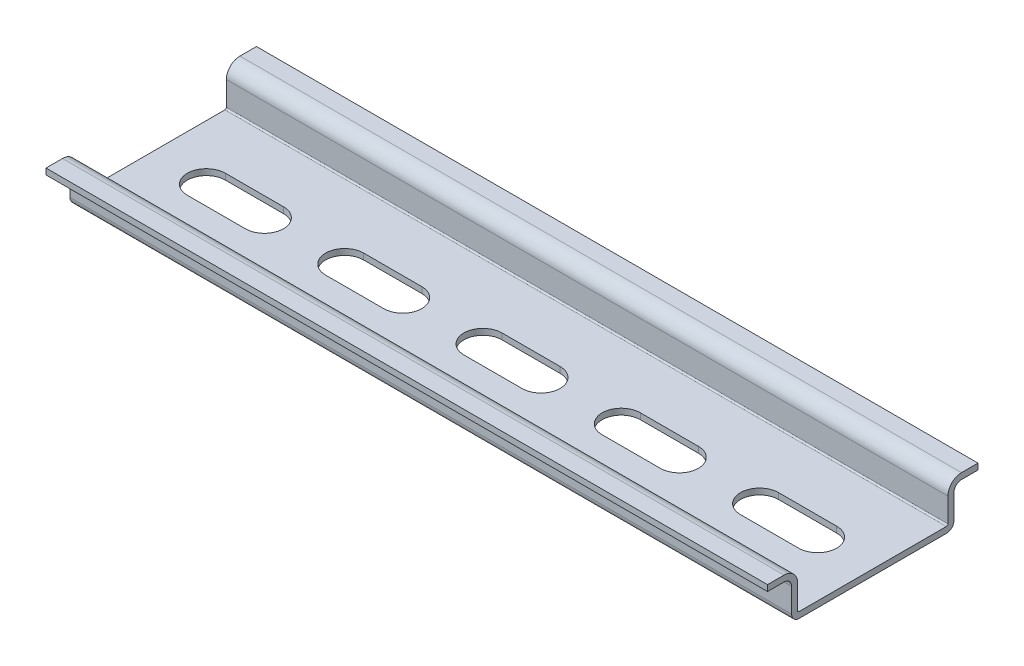
from build123d import *

# Parameters (mm, degrees)
BOSS_EXTRUDE1_DEPTH = 60
CUT_EXTRUDE1_DEPTH  = 120


with BuildPart() as part:
    # Sketch1 → Boss-Extrude1 (new, symmetric)
    with BuildSketch(Plane(origin=(0, 0, 0), x_dir=(0, 0, -1), z_dir=(1, 0, 0))):
        with BuildLine():
            Line((12.25, 0), (-12.25, 0))
            ThreePointArc((-12.25, 0), (-13.133883476, 0.366116524), (-13.5, 1.25))
            Line((-13.5, 1.25), (-13.5, 5.25))
            ThreePointArc((-13.5, 5.25), (-13.866116524, 6.133883476), (-14.75, 6.5))
            Line((-14.75, 6.5), (-17.5, 6.5))
            Line((-17.5, 6.5), (-17.5, 7.5))
            Line((-17.5, 7.5), (-14.75, 7.5))
            ThreePointArc((-14.75, 7.5), (-13.159009742, 6.840990258), (-12.5, 5.25))
            Line((-12.5, 5.25), (-12.5, 1.25))
            ThreePointArc((-12.5, 1.25), (-12.426776695, 1.073223305), (-12.25, 1))
            Line((-12.25, 1), (12.25, 1))
            ThreePointArc((12.25, 1), (12.426776695, 1.073223305), (12.5, 1.25))
            Line((12.5, 1.25), (12.5, 5.25))
            ThreePointArc((12.5, 5.25), (13.159009742, 6.840990258), (14.75, 7.5))
            Line((14.75, 7.5), (17.5, 7.5))
            Line((17.5, 7.5), (17.5, 6.5))
            Line((17.5, 6.5), (14.75, 6.5))
            ThreePointArc((14.75, 6.5), (13.866116524, 6.133883476), (13.5, 5.25))
            Line((13.5, 5.25), (13.5, 1.25))
            ThreePointArc((13.5, 1.25), (13.133883476, 0.366116524), (12.25, 0))
        make_face()
    extrude(amount=BOSS_EXTRUDE1_DEPTH, both=True)

    # Sketch2 → Cut-Extrude1 (cut)
    with BuildSketch(Plane.XZ):
        with BuildLine():
            Line((-4.83, 3.17), (4.83, 3.17))
            ThreePointArc((4.83, 3.17), (8, 0), (4.83, -3.17))
            Line((4.83, -3.17), (-4.83, -3.17))
            ThreePointArc((-4.83, -3.17), (-8, 0), (-4.83, 3.17))
        make_face()
        with BuildLine():
            Line((18.17, -3.17), (27.83, -3.17))
            ThreePointArc((27.83, -3.17), (31, 0), (27.83, 3.17))
            Line((27.83, 3.17), (18.17, 3.17))
            ThreePointArc((18.17, 3.17), (15, 0), (18.17, -3.17))
        make_face()
        with BuildLine():
            Line((-27.83, -3.17), (-18.17, -3.17))
            ThreePointArc((-18.17, -3.17), (-15, 0), (-18.17, 3.17))
            Line((-18.17, 3.17), (-27.83, 3.17))
            ThreePointArc((-27.83, 3.17), (-31, 0), (-27.83, -3.17))
        make_face()
        with BuildLine():
            Line((-50.83, 3.17), (-41.17, 3.17))
            ThreePointArc((-41.17, 3.17), (-38, 0), (-41.17, -3.17))
            Line((-41.17, -3.17), (-50.83, -3.17))
            ThreePointArc((-50.83, -3.17), (-54, 0), (-50.83, 3.17))
        make_face()
        with BuildLine():
            Line((41.17, 3.17), (50.83, 3.17))
            ThreePointArc((50.83, 3.17), (54, 0), (50.83, -3.17))
            Line((50.83, -3.17), (41.17, -3.17))
            ThreePointArc((41.17, -3.17), (38, 0), (41.17, 3.17))
        make_face()
    extrude(amount=-CUT_EXTRUDE1_DEPTH, mode=Mode.SUBTRACT)


solid = part.part
